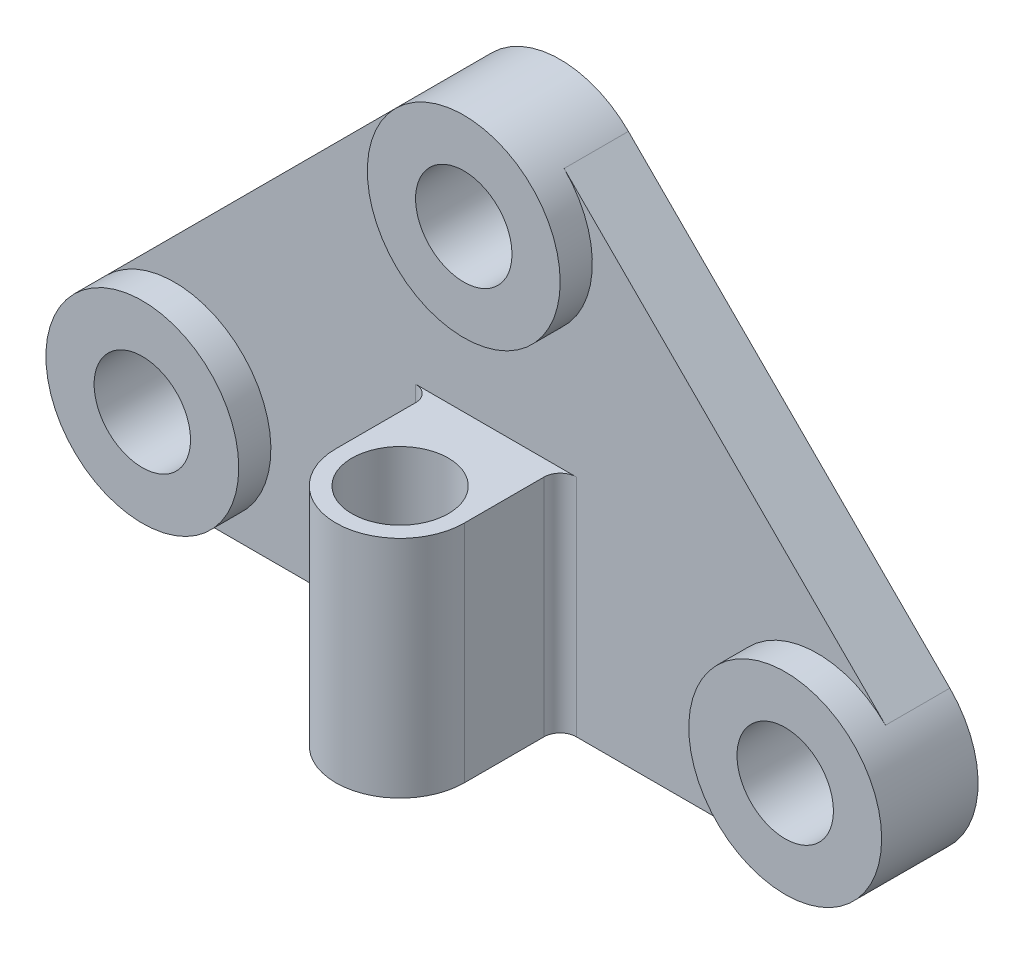
from build123d import *

# Parameters (mm, degrees)
SKETCH2_R           = 15
BOSS_EXTRUDE2_DEPTH = 20
SKETCH3_R           = 30
SKETCH3_R_2         = 15
BOSS_EXTRUDE3_DEPTH = 10
SKETCH4_R           = 15
BOSS_EXTRUDE4_DEPTH = 70
FILLET1_R           = 5
FILLET2_R           = 5


with BuildPart() as part:
    # Sketch2 → Boss-Extrude2 (new body)
    with BuildSketch(Plane.XY):
        with BuildLine():
            Line((-100, -30), (100, -30))
            ThreePointArc((100, -30), (127.716385975, -11.480502971), (121.213203436, 21.213203436))
            Line((121.213203436, 21.213203436), (21.213203436, 121.213203436))
            ThreePointArc((21.213203436, 121.213203436), (0, 130), (-21.213203436, 121.213203436))
            Line((-21.213203436, 121.213203436), (-121.213203436, 21.213203436))
            ThreePointArc((-121.213203436, 21.213203436), (-127.716385975, -11.480502971), (-100, -30))
        make_face()
        with Locations((100, 0)):
            Circle(SKETCH2_R, mode=Mode.SUBTRACT)
        with Locations((-100, 0)):
            Circle(SKETCH2_R, mode=Mode.SUBTRACT)
        with Locations((0, 100)):
            Circle(SKETCH2_R, mode=Mode.SUBTRACT)
    extrude(amount=BOSS_EXTRUDE2_DEPTH)

    # Sketch3 → Boss-Extrude3 (add)
    # profile 1 of 3: a face of its own
    with BuildSketch(Plane.XY.offset(20)):
        with Locations(Location((-100, 0, 0), (0, 0, 135))):
            Circle(SKETCH3_R)
        with Locations((-100, 0)):
            Circle(SKETCH3_R_2, mode=Mode.SUBTRACT)
    # profile 2 of 3: a face of its own
    with BuildSketch(Plane.XY.offset(20)):
        with Locations(Location((100, 0, 0), (0, 0, 270))):
            Circle(SKETCH3_R)
        with Locations((100, 0)):
            Circle(SKETCH3_R_2, mode=Mode.SUBTRACT)
    # profile 3 of 3: a face of its own
    with BuildSketch(Plane.XY.offset(20)):
        with Locations(Location((0, 100, 0), (0, 0, 135))):
            Circle(SKETCH3_R)
        with Locations((0, 100)):
            Circle(SKETCH3_R_2, mode=Mode.SUBTRACT)
    extrude(amount=BOSS_EXTRUDE3_DEPTH)

    # Sketch4 → Boss-Extrude4 (add)
    with BuildSketch(Plane.XZ.offset(30)):
        with BuildLine():
            Line((20, 49.8), (20, 20))
            Line((20, 20), (-20, 20))
            Line((-20, 20), (-20, 49.8))
            ThreePointArc((-20, 49.8), (0, 69.8), (20, 49.8))
        make_face()
        with Locations(Location((0, 49.8, 0), (0, 0, 270))):
            Circle(SKETCH4_R, mode=Mode.SUBTRACT)
    extrude(amount=-BOSS_EXTRUDE4_DEPTH)

    # Fillet1
    fillet1_edges = [part.edges().sort_by_distance(p)[0] for p in [
        (20, 5, 20),
    ]]
    fillet(fillet1_edges, radius=FILLET1_R)

    # Fillet2
    fillet2_edges = [part.edges().sort_by_distance(p)[0] for p in [
        (-20, 5, 20),
    ]]
    fillet(fillet2_edges, radius=FILLET2_R)


solid = part.part
